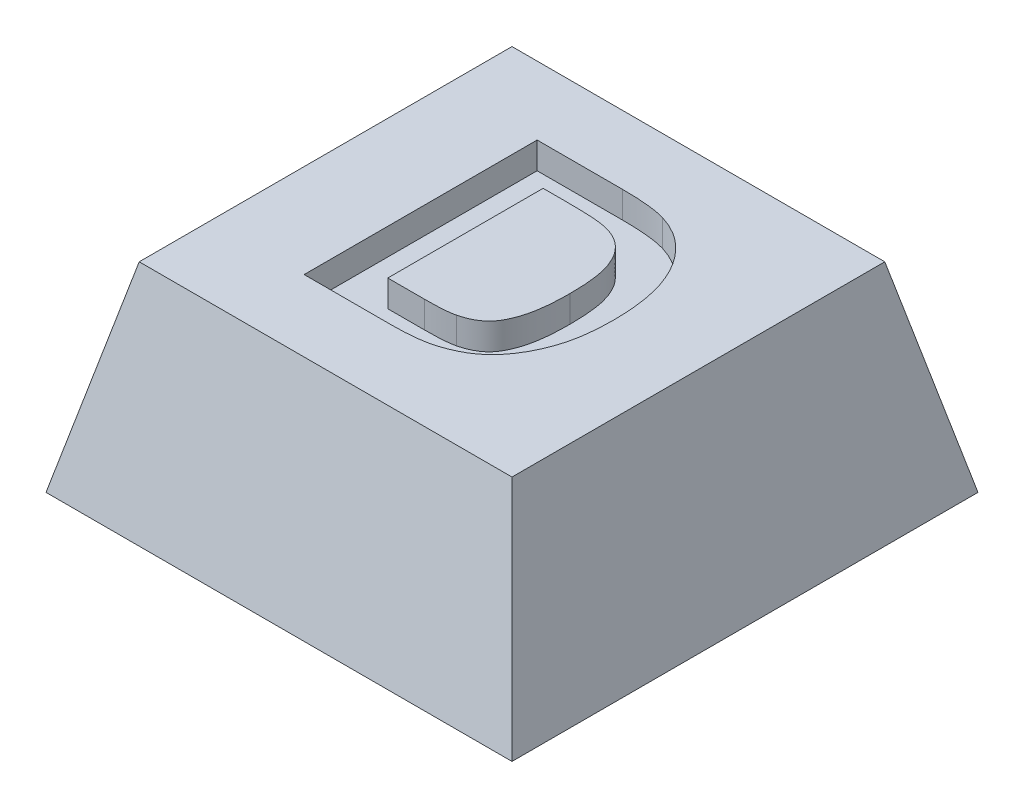
from build123d import *

# Parameters (mm, degrees)
SKETCH1_W           = 7
SKETCH1_H           = 7
BOSS_EXTRUDE1_DEPTH = 3
CUT_EXTRUDE1_DEPTH  = 7
CUT_EXTRUDE2_DEPTH  = 11
SKETCH4_R           = 1.8
CUT_EXTRUDE3_DEPTH  = 0.8
CUT_EXTRUDE4_DEPTH  = 0.4


with BuildPart() as part:
    # Sketch1 → Boss-Extrude1 (new body)
    with BuildSketch(Plane(origin=(0, 0, 0), x_dir=(1, 0, 0), z_dir=(0, 1, 0))):
        with Locations((3.5, 3.5)):
            Rectangle(SKETCH1_W, SKETCH1_H)
    extrude(amount=BOSS_EXTRUDE1_DEPTH)

    # Sketch2 → Cut-Extrude1 (cut)
    with BuildSketch(Plane.XY):
        Polygon((0, 0), (0.7, 3), (0, 3), align=None)
        Polygon((7, 0), (6.3, 3), (7, 3), align=None)
    extrude(amount=-CUT_EXTRUDE1_DEPTH, mode=Mode.SUBTRACT)

    # Sketch3 → Cut-Extrude2 (cut)
    with BuildSketch(Plane(origin=(0, 0, 0), x_dir=(0, 0, -1), z_dir=(1, 0, 0))):
        Polygon((0, 0), (0.7, 3), (0, 3), align=None)
        Polygon((7, 3), (6.3, 3), (7, 0), align=None)
    extrude(amount=CUT_EXTRUDE2_DEPTH, mode=Mode.SUBTRACT)

    # Sketch4 → Cut-Extrude3 (cut)
    with BuildSketch(Plane.XZ):
        with Locations(Location((3.5, -3.5, 0), (0, 0, 270))):
            Circle(SKETCH4_R)
    extrude(amount=-CUT_EXTRUDE3_DEPTH, mode=Mode.SUBTRACT)

    # Sketch5 → Cut-Extrude4 (cut)
    with BuildSketch(Plane(origin=(0, 3, 0), x_dir=(1, 0, 0), z_dir=(0, 1, 0))):
        with BuildLine():
            Line((2.104762775, 5.272776287), (3.388516782, 5.272776287))
            add(Edge.make_bspline(
                [(3.388516782, 5.272776287), (3.423578188, 5.272794463), (3.49185089, 5.272829856), (3.590932455, 5.26871941), (3.683586456, 5.264584843), (3.769546954, 5.256308342), (3.849112172, 5.247633102), (3.922424888, 5.236649595), (3.989021979, 5.222573028), (4.031018068, 5.211471972), (4.051076878, 5.206169716)],
                knots=[0, 0, 0, 0, 1.259756885, 2.453039283, 3.563158368, 4.591894114, 5.55549294, 6.43918076, 7.254497783, 8, 8, 8, 8], degree=3))
            add(Edge.make_bspline(
                [(4.051076878, 5.206169716), (4.076161646, 5.197994199), (4.125879345, 5.181790425), (4.198767023, 5.153398715), (4.267824301, 5.118187268), (4.335613125, 5.081173488), (4.399107207, 5.037408997), (4.461666778, 4.991877903), (4.519231823, 4.939134894), (4.594720977, 4.865423065), (4.680859839, 4.762740157), (4.771103422, 4.626536439), (4.847485635, 4.477034119), (4.899673474, 4.343085246), (4.93491273, 4.229217389), (4.957948246, 4.137924241), (4.977515517, 4.041758553), (4.993580306, 3.940696082), (5.006062185, 3.834736813), (5.015355077, 3.72390899), (5.019881652, 3.608116873), (5.020906543, 3.529323002), (5.021429442, 3.489122441)],
                knots=[0, 0, 0, 0, 0.745524535, 1.477620414, 2.207090574, 2.934465325, 3.657932502, 4.384347339, 5.118673636, 5.861150177, 7.365375624, 8.894729774, 10.468936425, 12.099947606, 12.950091786, 13.83580991, 14.759228729, 15.722225242, 16.726454549, 17.773376212, 18.863978586, 20, 20, 20, 20], degree=3))
            add(Edge.make_bspline(
                [(5.021429442, 3.489122441), (5.020474912, 3.419643533), (5.01862887, 3.285272719), (4.99724236, 3.091376197), (4.966421697, 2.911281512), (4.931680416, 2.798930618), (4.914858929, 2.744531095)],
                knots=[0, 0, 0, 0, 1.103207939, 2.133582005, 3.096293362, 4, 4, 4, 4], degree=3))
            add(Edge.make_bspline(
                [(4.914858929, 2.744531095), (4.903751174, 2.713315462), (4.881900487, 2.651909444), (4.843663423, 2.56333096), (4.802348006, 2.479035433), (4.75761154, 2.399089275), (4.709228004, 2.323852087), (4.657016426, 2.253548907), (4.601786127, 2.187254174), (4.561774971, 2.146449452), (4.541862134, 2.126141671)],
                knots=[0, 0, 0, 0, 1.090884612, 2.145940218, 3.175104604, 4.181306866, 5.161203701, 6.118658341, 7.063689906, 8, 8, 8, 8], degree=3))
            add(Edge.make_bspline(
                [(4.541862134, 2.126141671), (4.509638353, 2.097162572), (4.443188324, 2.037403538), (4.326091991, 1.963449345), (4.193740208, 1.898101387), (4.098005021, 1.864533226), (4.048272391, 1.847095197)],
                knots=[0, 0, 0, 0, 0.908140292, 1.872714733, 2.8949153, 4, 4, 4, 4], degree=3))
            add(Edge.make_bspline(
                [(4.048272391, 1.847095197), (4.028252483, 1.840946487), (3.986702201, 1.828185158), (3.920820132, 1.814555795), (3.85048937, 1.800197126), (3.774898904, 1.791547242), (3.6948334, 1.782425557), (3.60965481, 1.77730424), (3.519658403, 1.773668403), (3.457932074, 1.773078068), (3.426377359, 1.772776287)],
                knots=[0, 0, 0, 0, 0.799129865, 1.658552685, 2.566799617, 3.538529252, 4.561352959, 5.643373779, 6.795284424, 8, 8, 8, 8], degree=3))
            Line((3.426377359, 1.772776287), (2.104762775, 1.772776287))
            Line((2.104762775, 1.772776287), (2.104762775, 5.272776287))
        make_face()
        with BuildLine():
            Line((2.777839698, 4.689442953), (2.777839698, 2.35610962))
            Line((2.777839698, 2.35610962), (3.331725916, 2.35610962))
            add(Edge.make_bspline(
                [(3.331725916, 2.35610962), (3.356732427, 2.356307939), (3.404879513, 2.356689778), (3.474549579, 2.357811767), (3.538575784, 2.360849202), (3.597293536, 2.36399549), (3.65054997, 2.369193709), (3.698576813, 2.374306355), (3.741106724, 2.38145884), (3.767374243, 2.387104916), (3.779742743, 2.389763466)],
                knots=[0, 0, 0, 0, 1.333384787, 2.567275092, 3.714769766, 4.750907381, 5.701951617, 6.567520054, 7.325492842, 8, 8, 8, 8], degree=3))
            add(Edge.make_bspline(
                [(3.779742743, 2.389763466), (3.808711174, 2.397493681), (3.865134036, 2.412550099), (3.944357438, 2.44611519), (4.01604441, 2.486607799), (4.08139549, 2.535298421), (4.140290341, 2.596832105), (4.190564295, 2.675528863), (4.237091515, 2.769385848), (4.268953366, 2.859230456), (4.291823741, 2.939477558), (4.307305109, 3.006830931), (4.319539616, 3.07970047), (4.330062887, 3.157798585), (4.338565941, 3.241024846), (4.343856943, 3.329679796), (4.347468084, 3.423654914), (4.348052123, 3.488183941), (4.348352519, 3.521374043)],
                knots=[0, 0, 0, 0, 1.038686998, 2.023088296, 2.974059649, 3.888265163, 4.839857954, 5.909819677, 7.113156087, 8.466843969, 9.20827164, 10.006482943, 10.861893492, 11.769681931, 12.739021491, 13.762258324, 14.849031541, 16, 16, 16, 16], degree=3))
            add(Edge.make_bspline(
                [(4.348352519, 3.521374043), (4.348054433, 3.554564247), (4.347476984, 3.618859926), (4.34387138, 3.712134321), (4.338610098, 3.799393203), (4.330046489, 3.880744437), (4.319686346, 3.956300457), (4.307308533, 4.0261252), (4.291920489, 4.089760429), (4.26903066, 4.165360255), (4.234330859, 4.250336809), (4.187111202, 4.343245577), (4.129123838, 4.422434336), (4.065053447, 4.491226906), (3.991179205, 4.547839715), (3.909400596, 4.595256239), (3.817937068, 4.632059083), (3.752876188, 4.647734621), (3.719446269, 4.655789107)],
                knots=[0, 0, 0, 0, 1.117996097, 2.165769068, 3.143980016, 4.062055362, 4.920439205, 5.712587309, 6.449616741, 7.124491204, 8.371470382, 9.537068822, 10.625202851, 11.666538334, 12.693249444, 13.747832046, 14.842779399, 16, 16, 16, 16], degree=3))
            add(Edge.make_bspline(
                [(3.719446269, 4.655789107), (3.704976171, 4.658477854), (3.673118556, 4.664397445), (3.620253908, 4.671311562), (3.558231897, 4.676442427), (3.486736347, 4.68168059), (3.406056748, 4.684670369), (3.31585552, 4.687790688), (3.21651011, 4.688856584), (3.147096928, 4.68924188), (3.110872551, 4.689442953)],
                knots=[0, 0, 0, 0, 0.578738571, 1.274160813, 2.095454135, 3.025967819, 4.093109015, 5.270126069, 6.575371698, 8, 8, 8, 8], degree=3))
            Line((3.110872551, 4.689442953), (2.777839698, 4.689442953))
        make_face(mode=Mode.SUBTRACT)
    extrude(amount=-CUT_EXTRUDE4_DEPTH, mode=Mode.SUBTRACT)


solid = part.part
